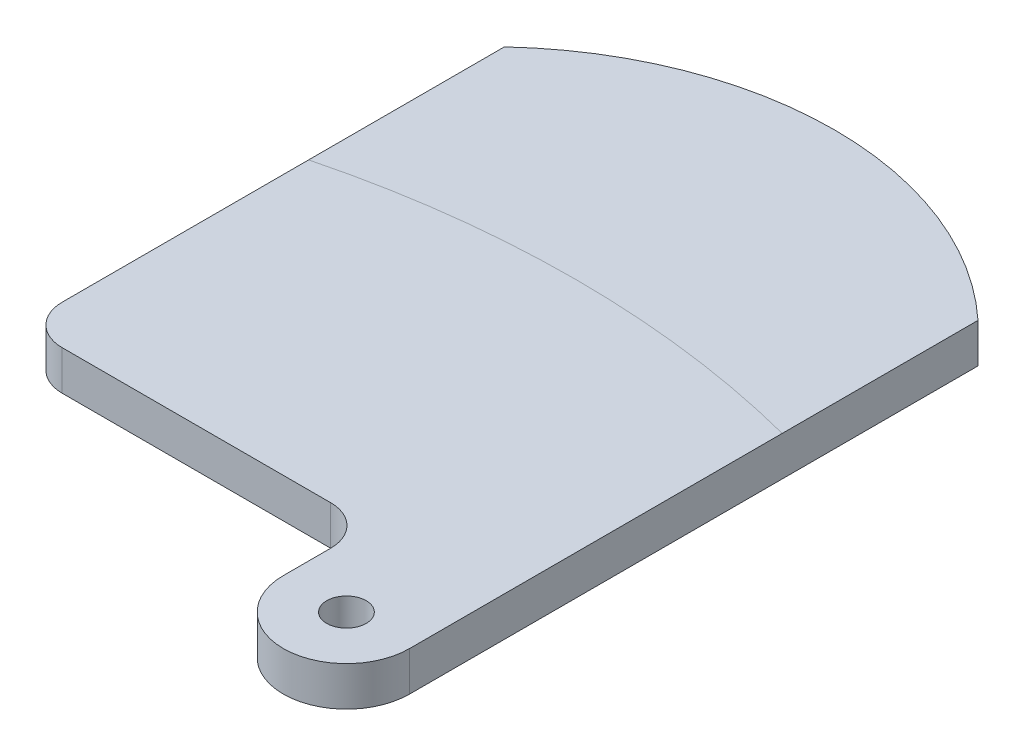
from build123d import *

# Parameters (mm, degrees)
BOSS_EXTRUDE1_DEPTH        = 3.175
F_1_8_0_1250_DOWEL_HOLE1_D = 3.175
F_1_8_0_1250_DOWEL_HOLE2_D = 3.175


with BuildPart() as part:
    # Sketch1 → Boss-Extrude1 (new body)
    with BuildSketch(Plane(origin=(0, 0, 0), x_dir=(1, 0, 0), z_dir=(0, 1, 0))):
        with BuildLine():
            Line((-19.05, 10.16), (-19.05, 45.72))
            ThreePointArc((-19.05, 45.72), (0, 53.221284287), (19.05, 45.72))
            Line((19.05, 45.72), (19.05, 10.16))
            Line((19.05, 10.16), (19.05, 0))
            ThreePointArc((19.05, 0), (13.97, -5.08), (8.89, 0))
            Line((8.89, 0), (8.89, 3.81))
            ThreePointArc((8.89, 3.81), (7.96006403, 6.05506403), (5.715, 6.985))
            Line((5.715, 6.985), (-15.875, 6.985))
            ThreePointArc((-15.875, 6.985), (-18.12006403, 7.91493597), (-19.05, 10.16))
        make_face()
    extrude(amount=BOSS_EXTRUDE1_DEPTH)

    # 1/8 (0.1250) Dowel Hole1 (through all)
    with Locations(Plane(origin=(0, 3.175, 0), x_dir=(1, 0, 0), z_dir=(0, 1, 0))):
        with Locations((13.97, 0)):
            Hole(F_1_8_0_1250_DOWEL_HOLE1_D / 2)

    # 1/8 (0.1250) Dowel Hole2 (through all)
    with Locations(Plane(origin=(0, 3.175, 0), x_dir=(1, 0, 0), z_dir=(0, 1, 0))):
        with Locations((-16.306687583, 55.676687583)):
            Hole(F_1_8_0_1250_DOWEL_HOLE2_D / 2)


solid = part.part
